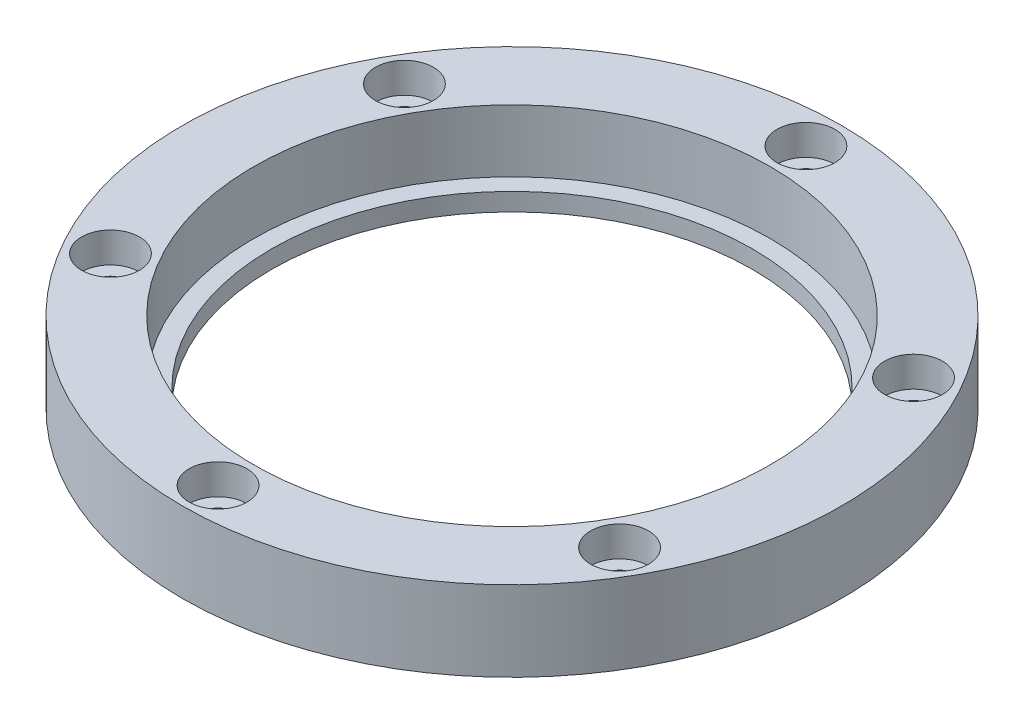
from build123d import *

# Parameters (mm, degrees)
CBORE_FOR_M3_HEX_SOCKET_HEAD_CAP_SCREW1_D           = 3.4
CBORE_FOR_M3_HEX_SOCKET_HEAD_CAP_SCREW1_CBORE_D     = 6.5
CBORE_FOR_M3_HEX_SOCKET_HEAD_CAP_SCREW1_CBORE_DEPTH = 3.4


with BuildPart() as part:
    # Sketch1 → Revolve1 (revolve)
    with BuildSketch(Plane.XY, mode=Mode.PRIVATE) as revolve1_sk:
        Polygon((27, 0), (37, 0), (37, 9), (29, 9), (29, 2), (27, 2), align=None)
    revolve(revolve1_sk.sketch.rotate(Axis((0, 0, 0), (0, 1, 0)), 90), axis=Axis((0, 0, 0), (0, 1, 0)))

    # CBORE for M3 Hex Socket Head Cap Screw1 (through all)
    with Locations(Plane(origin=(0, 9, 0), x_dir=(1, 0, 0), z_dir=(0, 1, 0))):
        with Locations((28.578838325, -16.5), (0, -33), (-28.578838325, -16.5), (-28.578838325, 16.5), (0, 33), (28.578838325, 16.5)):
            CounterBoreHole(CBORE_FOR_M3_HEX_SOCKET_HEAD_CAP_SCREW1_D / 2, CBORE_FOR_M3_HEX_SOCKET_HEAD_CAP_SCREW1_CBORE_D / 2, CBORE_FOR_M3_HEX_SOCKET_HEAD_CAP_SCREW1_CBORE_DEPTH)


solid = part.part
